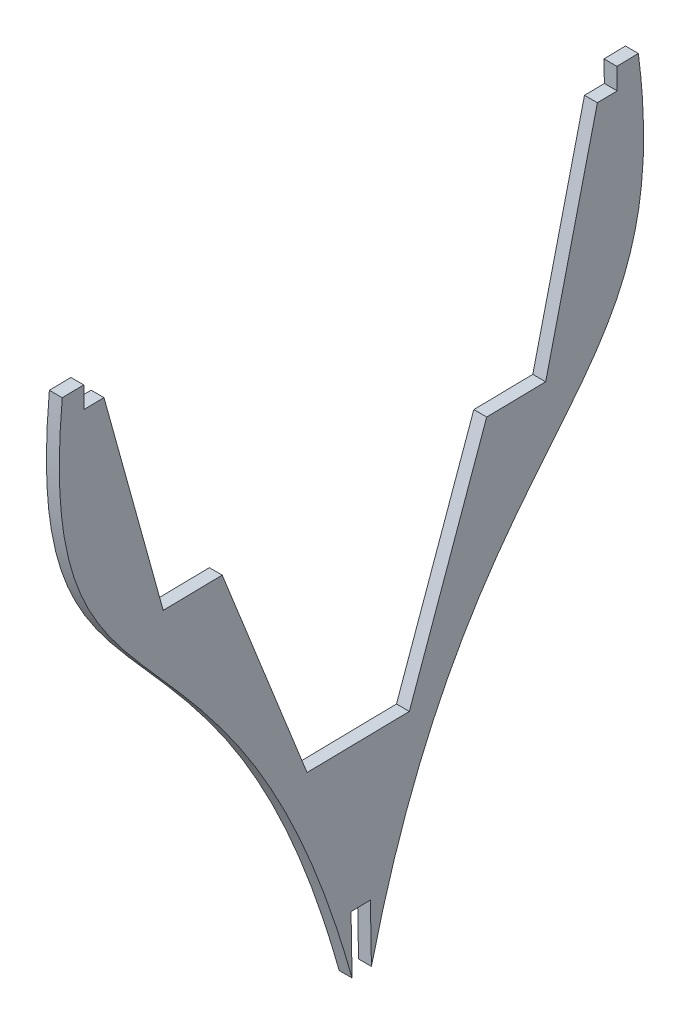
from build123d import *

# Parameters (mm, degrees)
BOSS_EXTRU_3_DEPTH      = 6
ENL_V_MAT_EXTRU_1_DEPTH = 6


with BuildPart() as part:
    # Esquisse2 → Boss.-Extru.3 (new body)
    with BuildSketch(Plane(origin=(0, 0, 0), x_dir=(0, 0, -1), z_dir=(1, 0, 0))):
        with BuildLine():
            Line((-140.416679055, 360.566258288), (-130.416679055, 360.741579264))
            Line((-130.416679055, 360.741579264), (-130.241358078, 350.741579264))
            Line((-130.241358078, 350.741579264), (-121.002285999, 350.903559578))
            Line((-121.002285999, 350.903559578), (-93.433601373, 251.371528907))
            Line((-93.433601373, 251.371528907), (-65.980874162, 251.852832801))
            Line((-65.980874162, 251.852832801), (-26.481318732, 152.529975322))
            Line((-26.481318732, 152.529975322), (21.118346969, 153.364497309))
            Line((21.118346969, 153.364497309), (57.112021637, 254.01090947))
            Line((57.112021637, 254.01090947), (84.564748849, 254.492213364))
            Line((84.564748849, 254.492213364), (108.627552714, 354.929452332))
            Line((108.627552714, 354.929452332), (117.866624793, 355.091432646))
            Line((117.866624793, 355.091432646), (117.691303816, 365.091432646))
            Line((117.691303816, 365.091432646), (127.691303816, 365.266753623))
            add(Edge.make_bspline(
                [(127.691303816, 365.266753623), (147.184559887, 215.910377385), (46.213287181, 260.979009095), (-0.72013158, 41.075038186)],
                knots=[0, 0, 0, 0, 1, 1, 1, 1], degree=3))
            add(Edge.make_bspline(
                [(-140.416679055, 360.566258288), (-154.66250345, 210.618365197), (-55.333093359, 259.198688036), (-0.72013158, 41.075038186)],
                knots=[0, 0, 0, 0, 1, 1, 1, 1], degree=3))
        make_face()
    extrude(amount=BOSS_EXTRU_3_DEPTH)

    # Esquisse3 → Enlèv. mat.-Extru.1 (cut)
    with BuildSketch(Plane(origin=(6, 0, 0), x_dir=(0, 0, -1), z_dir=(1, 0, 0))):
        Polygon((-5.540103091, 59.246755688), (-6.013469727, 86.246755688), (2.986530273, 86.404544567), (3.459896909, 59.404544567), (37.668799689, 18.951468612), (-34.085517668, 23.749883049), align=None)
    extrude(amount=-ENL_V_MAT_EXTRU_1_DEPTH, mode=Mode.SUBTRACT)


solid = part.part
